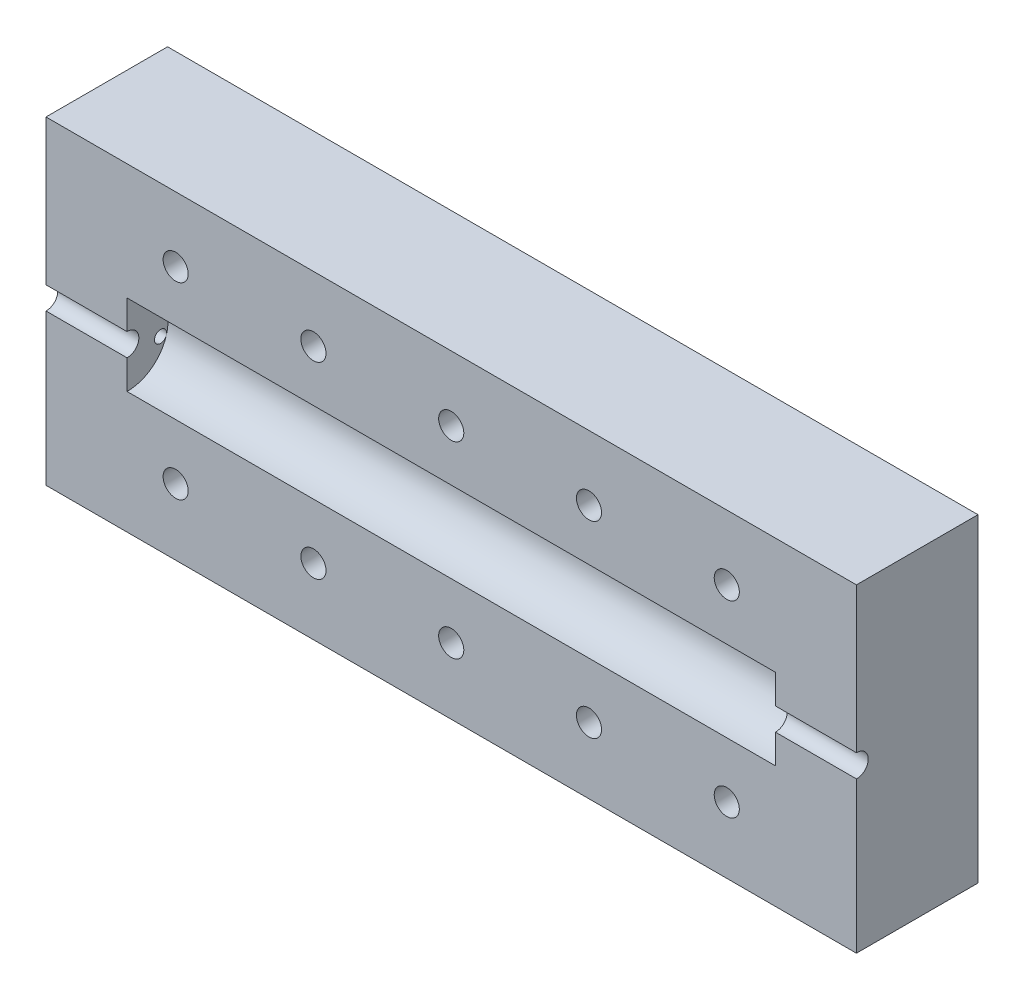
from build123d import *

# Parameters (mm, degrees)
SKIZZE2_W                            = 100
SKIZZE2_H                            = 39.364160046
AUFSATZ_LINEAR_AUSTRAGEN1_DEPTH      = 30
SCHNITT_LINEAR_AUSTRAGEN1_DEPTH      = 40
SCHNITT_LINEAR_AUSTRAGEN1_DEPTH_BACK = 40
SKIZZE10_R                           = 5
SKIZZE17_R                           = 1.4
SCHNITT_LINEAR_AUSTRAGEN2_DEPTH      = 103.710939516
SKIZZE24_R                           = 1.55
SCHNITT_LINEAR_AUSTRAGEN4_DEPTH      = 112.577493681
SKIZZE37_R                           = 0.736865544
SCHNITT_LINEAR_AUSTRAGEN9_DEPTH      = 112.577493681
SKIZZE40_R                           = 2.1
SCHNITT_LINEAR_AUSTRAGEN10_DEPTH     = 6
SKIZZE42_R                           = 0.75
SCHNITT_LINEAR_AUSTRAGEN12_DEPTH     = 10
VERRUNDUNG1_R                        = 1
SKIZZE46_R                           = 2.85
SCHNITT_LINEAR_AUSTRAGEN15_DEPTH     = 10
SCHNITT_LINEAR_START                 = -5
SCHNITT_LINEAR_AUSTRAGEN25_DEPTH     = 2.7
LINEARES_MUSTER1_COUNT               = 5
LINEARES_MUSTER1_PITCH               = 17
SPIEGELN2_COPY_1_SKETCH_R            = 2.85
SPIEGELN2_COPY_1_DEPTH               = 10
SPIEGELN2_COPY_2_SKETCH_R            = 2.85
SPIEGELN2_COPY_2_DEPTH               = 10
SPIEGELN2_COPY_3_SKETCH_R            = 2.85
SPIEGELN2_COPY_3_DEPTH               = 10
SPIEGELN2_COPY_4_SKETCH_R            = 2.85
SPIEGELN2_COPY_4_DEPTH               = 10
SPIEGELN2_START                      = -5
SPIEGELN2_COPY_5_DEPTH               = 2.7
SPIEGELN2_COPY_6_DEPTH               = 2.7
SPIEGELN2_COPY_7_DEPTH               = 2.7
SPIEGELN2_COPY_8_DEPTH               = 2.7
SKIZZE51_W                           = 15
SKIZZE51_H                           = 39.364160046
SCHNITT_LINEAR_AUSTRAGEN26_DEPTH     = 112.577493681


with BuildPart() as part:
    # Skizze2 → Aufsatz-Linear austragen1 (new body)
    with BuildSketch(Plane.XY):
        with Locations((50, 19.682080023)):
            Rectangle(SKIZZE2_W, SKIZZE2_H)
    extrude(amount=AUFSATZ_LINEAR_AUSTRAGEN1_DEPTH)

    # Skizze10 → Schnitt-Linear austragen1 (cut, two sides: drawn at the far end of the back side and taken through both)
    with BuildSketch(Plane.ZY.offset(-50).offset(-SCHNITT_LINEAR_AUSTRAGEN1_DEPTH_BACK)):
        with Locations((14.945770016, 20.027045739)):
            Circle(SKIZZE10_R)
    extrude(amount=SCHNITT_LINEAR_AUSTRAGEN1_DEPTH + SCHNITT_LINEAR_AUSTRAGEN1_DEPTH_BACK, mode=Mode.SUBTRACT)

    # Skizze17 → Schnitt-Linear austragen2 (cut, through all)
    with BuildSketch(Plane.ZY.offset(-90)):
        with Locations((14.945770016, 20.027045739)):
            Circle(SKIZZE17_R)
    schnitt_linear_austragen2 = extrude(amount=-SCHNITT_LINEAR_AUSTRAGEN2_DEPTH, mode=Mode.SUBTRACT)

    # Spiegeln1: Schnitt-Linear austragen2 across plane
    add(schnitt_linear_austragen2.mirror(Plane.ZY.offset(-50)), mode=Mode.SUBTRACT)

    # Skizze24 → Schnitt-Linear austragen4 (cut, through all)
    with BuildSketch(Plane.XY.offset(30)):
        with Locations((16, 31.364160046)):
            Circle(SKIZZE24_R)
        with Locations((33, 31.364160046)):
            Circle(SKIZZE24_R)
        with Locations((50, 31.364160046)):
            Circle(SKIZZE24_R)
        with Locations((67, 31.364160046)):
            Circle(SKIZZE24_R)
        with Locations((84, 31.364160046)):
            Circle(SKIZZE24_R)
    schnitt_linear_austragen4 = extrude(amount=-SCHNITT_LINEAR_AUSTRAGEN4_DEPTH, mode=Mode.SUBTRACT)

    # Skizze37 → Schnitt-Linear austragen9 (cut, through all)
    with BuildSketch(Plane(origin=(100, 0, 0), x_dir=(0, 0, -1), z_dir=(1, 0, 0))):
        with Locations((-18.924590299, 18.633559666)):
            Circle(SKIZZE37_R)
    extrude(amount=-SCHNITT_LINEAR_AUSTRAGEN9_DEPTH, mode=Mode.SUBTRACT)

    # Skizze40 → Schnitt-Linear austragen10 (cut)
    with BuildSketch(Plane(origin=(100, 0, 0), x_dir=(0, 0, -1), z_dir=(1, 0, 0))):
        with Locations((-18.924590299, 18.633559666)):
            Circle(SKIZZE40_R)
    extrude(amount=-SCHNITT_LINEAR_AUSTRAGEN10_DEPTH, mode=Mode.SUBTRACT)

    # Skizze42 → Schnitt-Linear austragen12 (cut)
    with BuildSketch(Plane.ZY):
        with Locations((10.86415918, 18.842582577)):
            Circle(SKIZZE42_R)
    extrude(amount=-SCHNITT_LINEAR_AUSTRAGEN12_DEPTH, mode=Mode.SUBTRACT)

    # Verrundung1
    verrundung1_edges = [part.edges().sort_by_distance(p)[0] for p in [
        (94, 18.633559666, 19.661455843),
    ]]
    fillet(verrundung1_edges, radius=VERRUNDUNG1_R)

    # Skizze46 → Schnitt-Linear austragen15 (cut)
    with BuildSketch(Plane(origin=(0, 0, 0), x_dir=(-1, 0, 0), z_dir=(0, 0, -1))):
        with Locations((-84, 31.364160046)):
            Circle(SKIZZE46_R)
    schnitt_linear_austragen15 = extrude(amount=-SCHNITT_LINEAR_AUSTRAGEN15_DEPTH, mode=Mode.SUBTRACT)

    # Skizze50 → Schnitt-Linear austragen25 (cut)
    with BuildSketch(Plane.XY.offset(30).offset(SCHNITT_LINEAR_START)):
        Polygon((81.15, 33.009608314), (81.15, 39.364160046), (86.85, 39.364160046), (86.85, 33.009608314), (86.85, 29.718711779), (84, 28.073263512), (81.15, 29.718711779), align=None)
    schnitt_linear_austragen25 = extrude(amount=-SCHNITT_LINEAR_AUSTRAGEN25_DEPTH, mode=Mode.SUBTRACT)

    # Lineares Muster1: Schnitt-Linear austragen15, Schnitt-Linear austragen25 ×5
    with Locations(*[(-i * LINEARES_MUSTER1_PITCH, 0, 0) for i in range(1, LINEARES_MUSTER1_COUNT)]):
        add(schnitt_linear_austragen15, mode=Mode.SUBTRACT)
        add(schnitt_linear_austragen25, mode=Mode.SUBTRACT)

    # Spiegeln2: Schnitt-Linear austragen15, Schnitt-Linear austragen25 across plane
    add(schnitt_linear_austragen15.mirror(Plane.ZX.offset(19.764160046)), mode=Mode.SUBTRACT)
    add(schnitt_linear_austragen25.mirror(Plane.ZX.offset(19.764160046)), mode=Mode.SUBTRACT)

    # Spiegeln2 copy 1 sketch → Spiegeln2 copy 1 (cut)
    with BuildSketch(Plane(origin=(-17, 39.528320093, 0), x_dir=(-1, 0, 0), z_dir=(0, 0, -1))):
        with Locations((-84, -31.364160046)):
            Circle(SPIEGELN2_COPY_1_SKETCH_R)
    extrude(amount=-SPIEGELN2_COPY_1_DEPTH, mode=Mode.SUBTRACT)

    # Spiegeln2 copy 2 sketch → Spiegeln2 copy 2 (cut)
    with BuildSketch(Plane(origin=(-34, 39.528320093, 0), x_dir=(-1, 0, 0), z_dir=(0, 0, -1))):
        with Locations((-84, -31.364160046)):
            Circle(SPIEGELN2_COPY_2_SKETCH_R)
    extrude(amount=-SPIEGELN2_COPY_2_DEPTH, mode=Mode.SUBTRACT)

    # Spiegeln2 copy 3 sketch → Spiegeln2 copy 3 (cut)
    with BuildSketch(Plane(origin=(-51, 39.528320093, 0), x_dir=(-1, 0, 0), z_dir=(0, 0, -1))):
        with Locations((-84, -31.364160046)):
            Circle(SPIEGELN2_COPY_3_SKETCH_R)
    extrude(amount=-SPIEGELN2_COPY_3_DEPTH, mode=Mode.SUBTRACT)

    # Spiegeln2 copy 4 sketch → Spiegeln2 copy 4 (cut)
    with BuildSketch(Plane(origin=(-68, 39.528320093, 0), x_dir=(-1, 0, 0), z_dir=(0, 0, -1))):
        with Locations((-84, -31.364160046)):
            Circle(SPIEGELN2_COPY_4_SKETCH_R)
    extrude(amount=-SPIEGELN2_COPY_4_DEPTH, mode=Mode.SUBTRACT)

    # Spiegeln2 copy 5 sketch → Spiegeln2 copy 5 (cut)
    with BuildSketch(Plane(origin=(-17, 39.528320093, 30), x_dir=(1, 0, 0), z_dir=(0, 0, 1)).offset(SPIEGELN2_START)):
        Polygon((81.15, -33.009608314), (81.15, -39.364160046), (86.85, -39.364160046), (86.85, -33.009608314), (86.85, -29.718711779), (84, -28.073263512), (81.15, -29.718711779), align=None)
    extrude(amount=-SPIEGELN2_COPY_5_DEPTH, mode=Mode.SUBTRACT)

    # Spiegeln2 copy 6 sketch → Spiegeln2 copy 6 (cut)
    with BuildSketch(Plane(origin=(-34, 39.528320093, 30), x_dir=(1, 0, 0), z_dir=(0, 0, 1)).offset(SPIEGELN2_START)):
        Polygon((81.15, -33.009608314), (81.15, -39.364160046), (86.85, -39.364160046), (86.85, -33.009608314), (86.85, -29.718711779), (84, -28.073263512), (81.15, -29.718711779), align=None)
    extrude(amount=-SPIEGELN2_COPY_6_DEPTH, mode=Mode.SUBTRACT)

    # Spiegeln2 copy 7 sketch → Spiegeln2 copy 7 (cut)
    with BuildSketch(Plane(origin=(-51, 39.528320093, 30), x_dir=(1, 0, 0), z_dir=(0, 0, 1)).offset(SPIEGELN2_START)):
        Polygon((81.15, -33.009608314), (81.15, -39.364160046), (86.85, -39.364160046), (86.85, -33.009608314), (86.85, -29.718711779), (84, -28.073263512), (81.15, -29.718711779), align=None)
    extrude(amount=-SPIEGELN2_COPY_7_DEPTH, mode=Mode.SUBTRACT)

    # Spiegeln2 copy 8 sketch → Spiegeln2 copy 8 (cut)
    with BuildSketch(Plane(origin=(-68, 39.528320093, 30), x_dir=(1, 0, 0), z_dir=(0, 0, 1)).offset(SPIEGELN2_START)):
        Polygon((81.15, -33.009608314), (81.15, -39.364160046), (86.85, -39.364160046), (86.85, -33.009608314), (86.85, -29.718711779), (84, -28.073263512), (81.15, -29.718711779), align=None)
    extrude(amount=-SPIEGELN2_COPY_8_DEPTH, mode=Mode.SUBTRACT)

    # Spiegeln3: Schnitt-Linear austragen4 across plane
    add(schnitt_linear_austragen4.mirror(Plane.ZX.offset(19.764160046)), mode=Mode.SUBTRACT)

    # Skizze51 → Schnitt-Linear austragen26 (cut, through all)
    with BuildSketch(Plane.ZY):
        with Locations((22.5, 19.682080023)):
            Rectangle(SKIZZE51_W, SKIZZE51_H)
    extrude(amount=-SCHNITT_LINEAR_AUSTRAGEN26_DEPTH, mode=Mode.SUBTRACT)


solid = part.part
